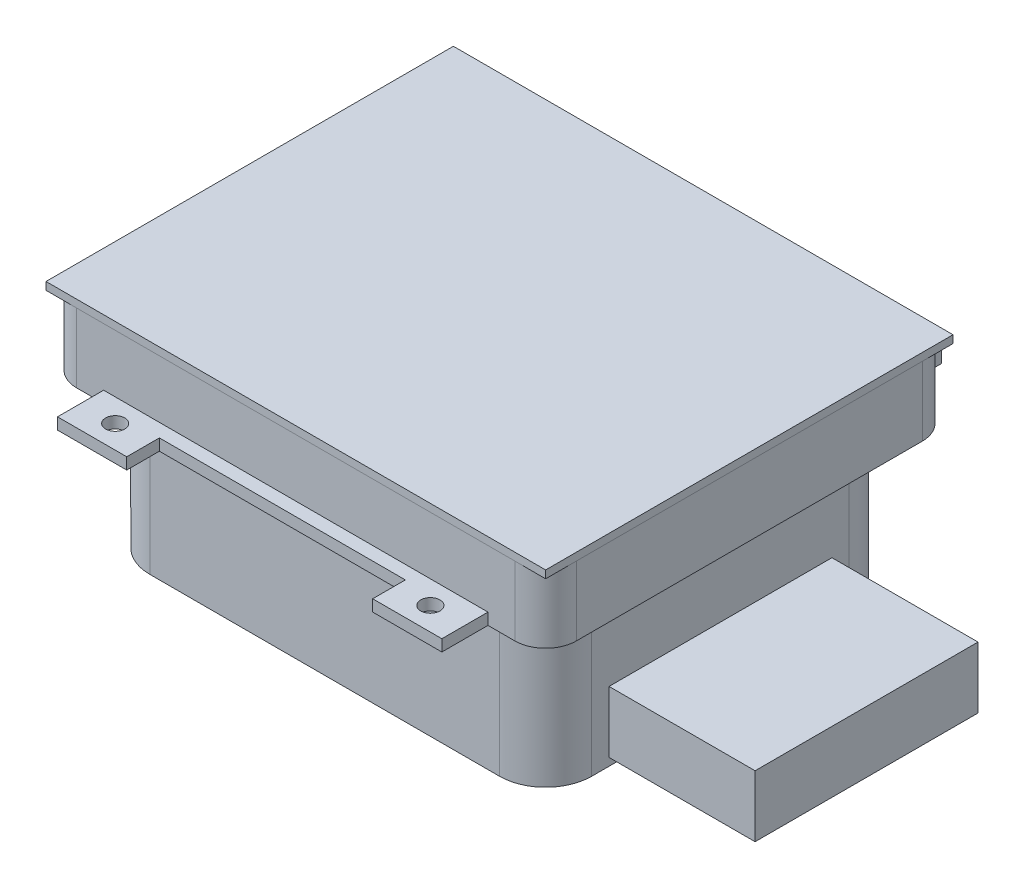
from build123d import *

# Parameters (mm, degrees)
SKETCH_1_W          = 65
SKETCH_1_H          = 53
EXTRUDE_1_DEPTH     = 9
SKETCH_3_R          = 1.25
EXTRUDE_2_DEPTH     = 1.5
SKETCH_4_W          = 57.5
SKETCH_4_H          = 45.5
EXTRUDE_3_DEPTH     = 20
CHAMFER_1_SIZE      = 2
SKETCH_5_W          = 53
SKETCH_5_H          = 41
CUT_EXTRUDE_1_DEPTH = 6
CUT_EXTRUDE_1_DRAFT = -60
SKETCH_6_W          = 65
SKETCH_6_H          = 53
EXTRUDE_4_DEPTH     = 1
SKETCH_7_R          = 3.233773826
CUT_EXTRUDE_2_DEPTH = 1
CUT_EXTRUDE_2_DRAFT = -60
SKETCH_8_W          = 29
SKETCH_8_H          = 8
EXTRUDE_5_DEPTH     = 19
FILLET_1_R          = 4
FILLET_2_R          = 6


with BuildPart() as part:
    # 草图1 → 凸台-拉伸1 (new body)
    with BuildSketch(Plane(origin=(0, 0, 0), x_dir=(1, 0, 0), z_dir=(0, 1, 0))):
        with Locations((0, 26.5)):
            Rectangle(SKETCH_1_W, SKETCH_1_H)
    extrude(amount=-EXTRUDE_1_DEPTH)

    # 草图3 → 凸台-拉伸2 (add)
    # profile 1 of 3: a face of its own
    with BuildSketch(Plane.XZ.offset(9)):
        Polygon((25, -59), (25, -53), (-25, -53), (-25, -59), (-16, -59), (-16, -54.75), (16, -54.75), (16, -59), align=None)
        with Locations(Location((-20.5, -56, 0), (0, 0, 270))):
            Circle(SKETCH_3_R, mode=Mode.SUBTRACT)
        with Locations(Location((20.5, -56, 0), (0, 0, 270))):
            Circle(SKETCH_3_R, mode=Mode.SUBTRACT)
    # profile 2 of 3: a face of its own
    with BuildSketch(Plane.XZ.offset(9)):
        Polygon((-25, 6), (-25, 0), (0, 0), (0, 1.75), (-16, 1.75), (-16, 6), align=None)
        with Locations(Location((-20.5, 3, 0), (0, 0, 270))):
            Circle(SKETCH_3_R, mode=Mode.SUBTRACT)
    # profile 3 of 3: a face of its own
    with BuildSketch(Plane.XZ.offset(9)):
        Polygon((0, 1.75), (0, 0), (25, 0), (25, 6), (16, 6), (16, 1.75), align=None)
        with Locations(Location((20.5, 3, 0), (0, 0, 270))):
            Circle(SKETCH_3_R, mode=Mode.SUBTRACT)
    extrude(amount=-EXTRUDE_2_DEPTH)

    # 草图4 → 凸台-拉伸3 (add)
    with BuildSketch(Plane(origin=(0, -29, 0), x_dir=(-1, 0, 0), z_dir=(0, -1, 0))):
        with Locations((0, 26.5)):
            Rectangle(SKETCH_4_W, SKETCH_4_H)
    extrude(amount=-EXTRUDE_3_DEPTH)

    # 倒角1
    chamfer_1_edges = [part.edges().sort_by_distance(p)[0] for p in [
        (0, -9, -3.75),
        (-28.75, -9, -26.5),
        (0, -9, -49.25),
        (28.75, -9, -26.5),
    ]]
    chamfer(chamfer_1_edges, length=CHAMFER_1_SIZE)


with BuildPart() as cut_extrude_1_tool:
    # 草图5 → 切除-拉伸1 (with draft: the straight prism first)
    with BuildSketch(Plane(origin=(0, 0, 0), x_dir=(1, 0, 0), z_dir=(0, 1, 0))):
        with Locations((0, 26.5)):
            Rectangle(SKETCH_5_W, SKETCH_5_H)
    extrude(amount=-CUT_EXTRUDE_1_DEPTH)
    # 切除-拉伸1: the draft: its side faces are tilted about the plane it starts from
    cut_extrude_1_sides = [cut_extrude_1_tool.faces().sort_by_distance(p)[0] for p in [
        (-26.5, -3, -26.5),
        (0, -3, -6),
        (26.5, -3, -26.5),
        (0, -3, -47),
    ]]
    draft(cut_extrude_1_sides, Plane(origin=(0, 0, 0), x_dir=(1, 0, 0), z_dir=(0, 1, 0)), CUT_EXTRUDE_1_DRAFT)


with BuildPart() as part_1:
    add(part.part)

    # 切除-拉伸1: cut by cut_extrude_1_tool
    add(cut_extrude_1_tool.part, mode=Mode.SUBTRACT)


with BuildPart() as body_2:
    # 草图6 → 凸台-拉伸4 (new body)
    with BuildSketch(Plane(origin=(0, 0, 0), x_dir=(1, 0, 0), z_dir=(0, 1, 0))):
        with Locations((0, 26.5)):
            Rectangle(SKETCH_6_W, SKETCH_6_H)
    extrude(amount=EXTRUDE_4_DEPTH)


with BuildPart() as cut_extrude_2_tool:
    # 草图7 → 切除-拉伸2 (with draft: the straight prism first)
    with BuildSketch(Plane(origin=(0, -6, 0), x_dir=(1, 0, 0), z_dir=(0, 1, 0))):
        with Locations((0, 26.5)):
            Circle(SKETCH_7_R)
    extrude(amount=-CUT_EXTRUDE_2_DEPTH)
    # 切除-拉伸2: the draft: its side faces are tilted about the plane it starts from
    cut_extrude_2_sides = [cut_extrude_2_tool.faces().sort_by_distance(p)[0] for p in [
        (-3.233773826, -6.5, -26.5),
    ]]
    draft(cut_extrude_2_sides, Plane(origin=(0, -6, 0), x_dir=(1, 0, 0), z_dir=(0, 1, 0)), CUT_EXTRUDE_2_DRAFT)


with BuildPart() as part_2:
    add(part_1.part)

    # 切除-拉伸2: cut by cut_extrude_2_tool
    add(cut_extrude_2_tool.part, mode=Mode.SUBTRACT)

    # 草图8 → 凸台-拉伸5 (add)
    with BuildSketch(Plane(origin=(28.75, 0, 0), x_dir=(0, 0, -1), z_dir=(1, 0, 0))):
        with Locations((26.5, -24)):
            Rectangle(SKETCH_8_W, SKETCH_8_H)
    extrude(amount=EXTRUDE_5_DEPTH)

    # 圆角1
    fillet_1_edges = [part_2.edges().sort_by_distance(p)[0] for p in [
        (-32.5, -4.5, -53),
        (32.5, -4.5, -53),
        (32.5, -4.5, 0),
        (-32.5, -4.5, 0),
    ]]
    fillet(fillet_1_edges, radius=FILLET_1_R)

    # 圆角2
    fillet_2_edges = [part_2.edges().sort_by_distance(p)[0] for p in [
        (28.75, -20, -49.25),
        (28.75, -20, -3.75),
        (-28.75, -20, -49.25),
        (-28.75, -20, -3.75),
    ]]
    fillet(fillet_2_edges, radius=FILLET_2_R)


solid = Compound([body_2.part, part_2.part])
